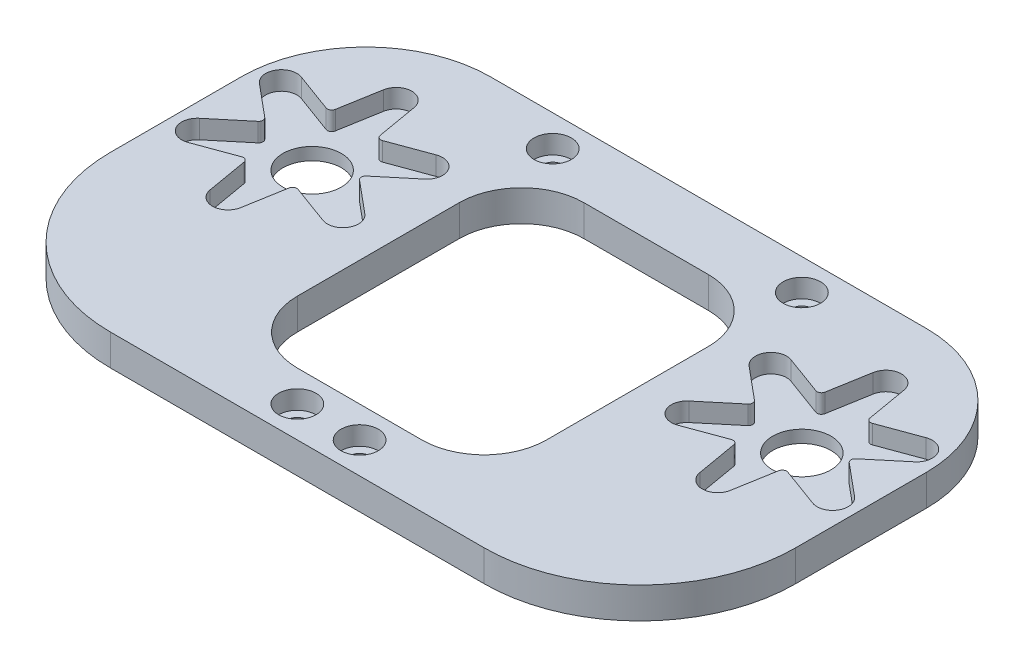
from build123d import *

# Parameters (mm, degrees)
CROQUIS1_R              = 1.6
CROQUIS1_R_2            = 4.6875
SALIENTE_EXTRUIR1_DEPTH = 5
CORTAR_EXTRUIR1_START   = -3
CROQUIS2_R              = 3
CROQUIS2_R_2            = 1.6
CROQUIS2_R_3            = 4.6875
CORTAR_EXTRUIR1_DEPTH   = 3


with BuildPart() as part:
    # Croquis1 → Saliente-Extruir1 (new body)
    with BuildSketch(Plane(origin=(0, 0, 0), x_dir=(1, 0, 0), z_dir=(0, 1, 0))):
        with BuildLine():
            Line((-30, -33), (30, -33))
            ThreePointArc((30, -33), (47.67766953, -25.67766953), (55, -8))
            Line((55, -8), (55, 13))
            ThreePointArc((55, 13), (49.142135624, 27.142135624), (35, 33))
            Line((35, 33), (-35, 33))
            ThreePointArc((-35, 33), (-49.142135624, 27.142135624), (-55, 13))
            Line((-55, 13), (-55, -8))
            ThreePointArc((-55, -8), (-47.67766953, -25.67766953), (-30, -33))
        make_face()
        with Locations(Location((5, -28, 0), (0, 0, 270))):
            Circle(CROQUIS1_R, mode=Mode.SUBTRACT)
        with Locations(Location((20, 28, 0), (0, 0, 270))):
            Circle(CROQUIS1_R, mode=Mode.SUBTRACT)
        with Locations(Location((39.3125, 8.6875, 0), (0, 0, 270))):
            Circle(CROQUIS1_R_2, mode=Mode.SUBTRACT)
        with Locations(Location((-5, -28, 0), (0, 0, 90))):
            Circle(CROQUIS1_R, mode=Mode.SUBTRACT)
        with Locations(Location((-39.3125, 8.6875, 0), (0, 0, 90))):
            Circle(CROQUIS1_R_2, mode=Mode.SUBTRACT)
        with Locations(Location((-20, 28, 0), (0, 0, 90))):
            Circle(CROQUIS1_R, mode=Mode.SUBTRACT)
        with BuildLine():
            Line((-10, -23), (10, -23))
            ThreePointArc((10, -23), (17.071067812, -20.071067812), (20, -13))
            Line((20, -13), (20, 13))
            ThreePointArc((20, 13), (17.071067812, 20.071067812), (10, 23))
            Line((10, 23), (-10, 23))
            ThreePointArc((-10, 23), (-17.071067812, 20.071067812), (-20, 13))
            Line((-20, 13), (-20, -13))
            ThreePointArc((-20, -13), (-17.071067812, -20.071067812), (-10, -23))
        make_face(mode=Mode.SUBTRACT)
    extrude(amount=SALIENTE_EXTRUIR1_DEPTH)

    # Croquis2 → Cortar-Extruir1 (cut)
    # profile 1 of 6: a face of its own
    with BuildSketch(Plane(origin=(0, 5, 0), x_dir=(1, 0, 0), z_dir=(0, 1, 0)).offset(CORTAR_EXTRUIR1_START)):
        with Locations(Location((20, 28, 0), (0, 0, 270))):
            Circle(CROQUIS2_R)
        with Locations(Location((20, 28, 0), (0, 0, 270))):
            Circle(CROQUIS2_R_2, mode=Mode.SUBTRACT)
    # profile 2 of 6: a face of its own
    with BuildSketch(Plane(origin=(0, 5, 0), x_dir=(1, 0, 0), z_dir=(0, 1, 0)).offset(CORTAR_EXTRUIR1_START)):
        with Locations(Location((5, -28, 0), (0, 0, 270))):
            Circle(CROQUIS2_R)
        with Locations(Location((5, -28, 0), (0, 0, 270))):
            Circle(CROQUIS2_R_2, mode=Mode.SUBTRACT)
    # profile 3 of 6: a face of its own
    with BuildSketch(Plane(origin=(0, 5, 0), x_dir=(1, 0, 0), z_dir=(0, 1, 0)).offset(CORTAR_EXTRUIR1_START)):
        with Locations(Location((-5, -28, 0), (0, 0, 90))):
            Circle(CROQUIS2_R)
    # profile 4 of 6: a face of its own
    with BuildSketch(Plane(origin=(0, 5, 0), x_dir=(1, 0, 0), z_dir=(0, 1, 0)).offset(CORTAR_EXTRUIR1_START)):
        with Locations(Location((-20, 28, 0), (0, 0, 90))):
            Circle(CROQUIS2_R)
    # profile 5 of 6: a face of its own
    with BuildSketch(Plane(origin=(0, 5, 0), x_dir=(1, 0, 0), z_dir=(0, 1, 0)).offset(CORTAR_EXTRUIR1_START)):
        with BuildLine():
            Line((35.705717307, 16.009871883), (36.849149414, 22.614001921))
            ThreePointArc((36.849149414, 22.614001921), (39.3125, 24.6875), (41.775850586, 22.614001921))
            Line((41.775850586, 22.614001921), (42.919282693, 16.009871883))
            ThreePointArc((42.919282693, 16.009871883), (43.259020857, 15.523074638), (43.85046872, 15.472251379))
            Line((43.85046872, 15.472251379), (50.141529157, 17.784075147))
            ThreePointArc((50.141529157, 17.784075147), (53.168906461, 16.6875), (52.604879743, 13.517426775))
            Line((52.604879743, 13.517426775), (47.457251413, 9.225120503))
            ThreePointArc((47.457251413, 9.225120503), (47.205541715, 8.6875), (47.457251413, 8.149879497))
            Line((47.457251413, 8.149879497), (52.604879743, 3.857573225))
            ThreePointArc((52.604879743, 3.857573225), (53.168906461, 0.6875), (50.141529157, -0.409075147))
            Line((50.141529157, -0.409075147), (43.85046872, 1.902748621))
            ThreePointArc((43.85046872, 1.902748621), (43.259020857, 1.851925362), (42.919282693, 1.365128117))
            Line((42.919282693, 1.365128117), (41.775850586, -5.239001921))
            ThreePointArc((41.775850586, -5.239001921), (39.3125, -7.3125), (36.849149414, -5.239001921))
            Line((36.849149414, -5.239001921), (35.705717307, 1.365128117))
            ThreePointArc((35.705717307, 1.365128117), (35.365979143, 1.851925362), (34.77453128, 1.902748621))
            Line((34.77453128, 1.902748621), (28.483470843, -0.409075147))
            ThreePointArc((28.483470843, -0.409075147), (25.456093539, 0.6875), (26.020120257, 3.857573225))
            Line((26.020120257, 3.857573225), (31.167748587, 8.149879497))
            ThreePointArc((31.167748587, 8.149879497), (31.419458285, 8.6875), (31.167748587, 9.225120503))
            Line((31.167748587, 9.225120503), (26.020120257, 13.517426775))
            ThreePointArc((26.020120257, 13.517426775), (25.456093539, 16.6875), (28.483470843, 17.784075147))
            Line((28.483470843, 17.784075147), (34.77453128, 15.472251379))
            ThreePointArc((34.77453128, 15.472251379), (35.365979143, 15.523074638), (35.705717307, 16.009871883))
        make_face()
        with Locations(Location((39.3125, 8.6875, 0), (0, 0, 270))):
            Circle(CROQUIS2_R_3, mode=Mode.SUBTRACT)
    # profile 6 of 6: a face of its own
    with BuildSketch(Plane(origin=(0, 5, 0), x_dir=(1, 0, 0), z_dir=(0, 1, 0)).offset(CORTAR_EXTRUIR1_START)):
        with BuildLine():
            Line((-34.77453128, 15.472251379), (-28.483470843, 17.784075147))
            ThreePointArc((-28.483470843, 17.784075147), (-25.456093539, 16.6875), (-26.020120257, 13.517426775))
            Line((-26.020120257, 13.517426775), (-31.167748587, 9.225120503))
            ThreePointArc((-31.167748587, 9.225120503), (-31.419458285, 8.6875), (-31.167748587, 8.149879497))
            Line((-31.167748587, 8.149879497), (-26.020120257, 3.857573225))
            ThreePointArc((-26.020120257, 3.857573225), (-25.456093539, 0.6875), (-28.483470843, -0.409075147))
            Line((-28.483470843, -0.409075147), (-34.77453128, 1.902748621))
            ThreePointArc((-34.77453128, 1.902748621), (-35.365979143, 1.851925362), (-35.705717307, 1.365128117))
            Line((-35.705717307, 1.365128117), (-36.849149414, -5.239001921))
            ThreePointArc((-36.849149414, -5.239001921), (-39.3125, -7.3125), (-41.775850586, -5.239001921))
            Line((-41.775850586, -5.239001921), (-42.919282693, 1.365128117))
            ThreePointArc((-42.919282693, 1.365128117), (-43.259020857, 1.851925362), (-43.85046872, 1.902748621))
            Line((-43.85046872, 1.902748621), (-50.141529157, -0.409075147))
            ThreePointArc((-50.141529157, -0.409075147), (-53.168906461, 0.6875), (-52.604879743, 3.857573225))
            Line((-52.604879743, 3.857573225), (-47.457251413, 8.149879497))
            ThreePointArc((-47.457251413, 8.149879497), (-47.205541715, 8.6875), (-47.457251413, 9.225120503))
            Line((-47.457251413, 9.225120503), (-52.604879743, 13.517426775))
            ThreePointArc((-52.604879743, 13.517426775), (-53.168906461, 16.6875), (-50.141529157, 17.784075147))
            Line((-50.141529157, 17.784075147), (-43.85046872, 15.472251379))
            ThreePointArc((-43.85046872, 15.472251379), (-43.259020857, 15.523074638), (-42.919282693, 16.009871883))
            Line((-42.919282693, 16.009871883), (-41.775850586, 22.614001921))
            ThreePointArc((-41.775850586, 22.614001921), (-39.3125, 24.6875), (-36.849149414, 22.614001921))
            Line((-36.849149414, 22.614001921), (-35.705717307, 16.009871883))
            ThreePointArc((-35.705717307, 16.009871883), (-35.365979143, 15.523074638), (-34.77453128, 15.472251379))
        make_face()
    extrude(amount=CORTAR_EXTRUIR1_DEPTH, mode=Mode.SUBTRACT)


solid = part.part
